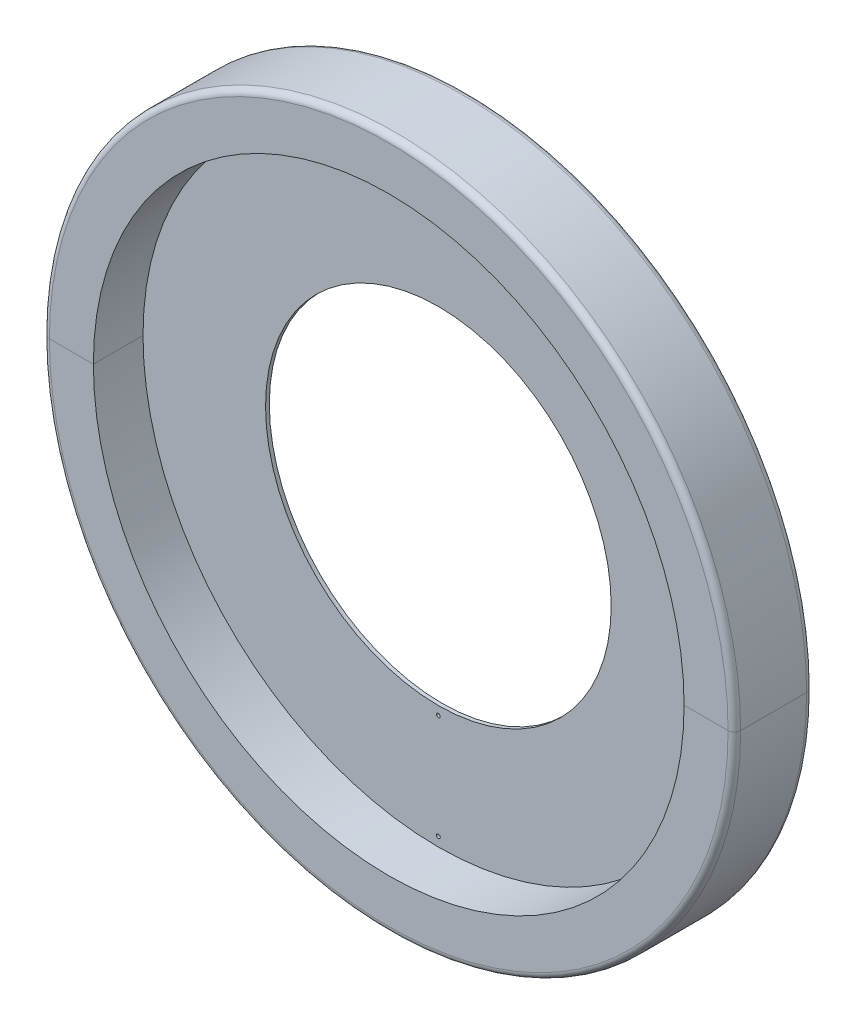
from build123d import *

# Parameters (mm, degrees)
ESBO_O1_R                = 470
RESSALTO_EXTRUS_O1_DEPTH = 6
ESBO_O2_R                = 275
CORTE_EXTRUS_O1_DEPTH    = 6
ESBO_O3_R                = 3
CORTE_EXTRUS_O2_DEPTH    = 6


with BuildPart() as part:
    # Esboço1 → Ressalto-extrusão1 (new body)
    with BuildSketch(Plane.XY):
        Circle(ESBO_O1_R)
    extrude(amount=RESSALTO_EXTRUS_O1_DEPTH)

    # Esboço2 → Corte-extrusão1 (cut)
    with BuildSketch(Plane.XY.offset(6)):
        Circle(ESBO_O2_R)
    extrude(amount=-CORTE_EXTRUS_O1_DEPTH, mode=Mode.SUBTRACT)

    # Esboço3 → Corte-extrusão2 (cut)
    with BuildSketch(Plane.XY.offset(6)):
        with Locations((0, -455)):
            Circle(ESBO_O3_R)
        with Locations((0, -288.71)):
            Circle(ESBO_O3_R)
    extrude(amount=-CORTE_EXTRUS_O2_DEPTH, mode=Mode.SUBTRACT)

    # Varredura1: sweep along a curve in space
    with BuildLine() as varredura1_path:
        ThreePointArc((470, 0, 0), (332.340187158, 332.340187158, 0), (0, 470, 0))
        ThreePointArc((0, 470, 0), (-332.340187158, 332.340187158, 0), (-470, 0, 0))
        ThreePointArc((-470, 0, 0), (-332.340187158, -332.340187158, 0), (0, -470, 0))
        ThreePointArc((0, -470, 0), (332.340187158, -332.340187158, 0), (470, 0, 0))
    # Esboço4 → Varredura1 (sweep)
    with BuildSketch(Plane(origin=(0, 0, 0), x_dir=(1, 0, 0), z_dir=(0, 1, 0))):
        with BuildLine():
            Line((-470, 0), (-470, 40))
            Line((-470, 40), (-540, 40))
            ThreePointArc((-540, 40), (-547.071067812, 37.071067812), (-550, 30))
            Line((-550, 30), (-550, -75))
            ThreePointArc((-550, -75), (-547.071067812, -82.071067812), (-540, -85))
            Line((-540, -85), (-470, -85))
            Line((-470, -85), (-470, 0))
        make_face()
    sweep(path=varredura1_path.line)


solid = part.part
